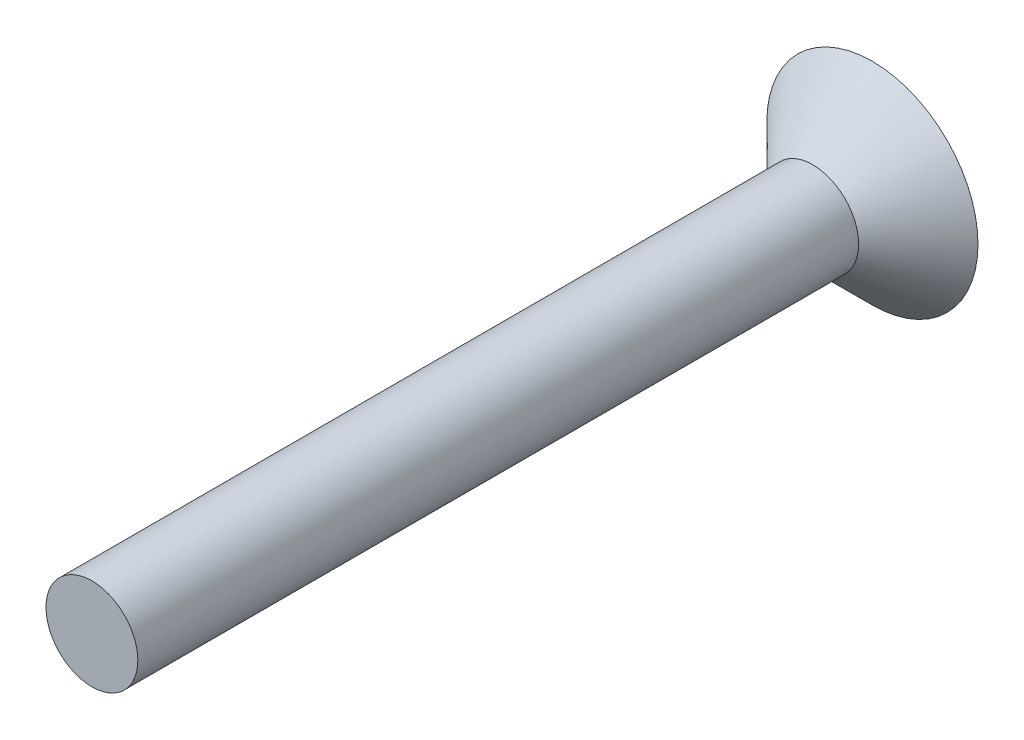
from build123d import *

# Parameters (mm, degrees)
SKETCH_1_R          = 2
EXTRUDE_1_DEPTH     = 34
CUT_EXTRUDE_1_DEPTH = 1.8


with BuildPart() as part:
    # 草图1 → 凸台-拉伸1 (new body)
    with BuildSketch(Plane.XY):
        Circle(SKETCH_1_R)
    extrude(amount=EXTRUDE_1_DEPTH)

    # 草图2 → 旋转1 (revolve)
    with BuildSketch(Plane(origin=(0, 0, 0), x_dir=(1, 0, 0), z_dir=(0, 1, 0)), mode=Mode.PRIVATE) as revolve_1_sk:
        Polygon((2, 0), (2, -2.6), (4.6, 0), align=None)
    revolve(revolve_1_sk.sketch.rotate(Axis((0, 0, 0), (0, 0, 1)), 180), axis=Axis((0, 0, 0), (0, 0, 1)))

    # 草图3 → 切除-拉伸1 (cut)
    with BuildSketch(Plane(origin=(0, 0, 0), x_dir=(-1, 0, 0), z_dir=(0, 0, -1))):
        Polygon((-0.59701127, 1.364689541), (-1.480361446, 0.165317844), (-0.883350176, -1.199371697), (0.59701127, -1.364689541), (1.480361446, -0.165317844), (0.883350176, 1.199371697), align=None)
    extrude(amount=-CUT_EXTRUDE_1_DEPTH, mode=Mode.SUBTRACT)


solid = part.part
